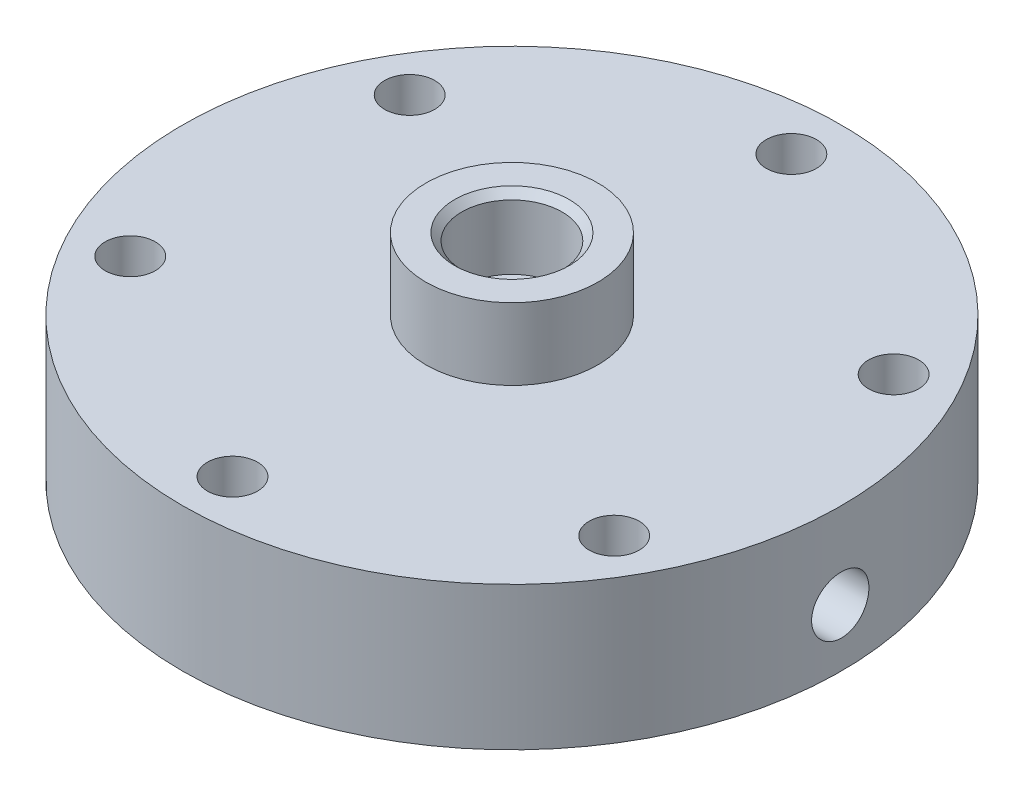
from build123d import *

# Parameters (mm, degrees)
SKETCH1_R           = 46
SKETCH1_R_2         = 3.5
BOSS_EXTRUDE1_DEPTH = 20
SKETCH2_R           = 12
BOSS_EXTRUDE2_DEPTH = 10
SKETCH3_R           = 33
CUT_EXTRUDE1_DEPTH  = 14
SKETCH4_R           = 2.5
CUT_EXTRUDE2_DEPTH  = 6
SKETCH5_R           = 7
CUT_EXTRUDE3_DEPTH  = 10
CHAMFER2_SIZE       = 1
SKETCH6_R           = 4
CUT_EXTRUDE4_DEPTH  = 72.637978754


with BuildPart() as part:
    # Sketch1 → Boss-Extrude1 (new body)
    with BuildSketch(Plane(origin=(0, 0, 0), x_dir=(1, 0, 0), z_dir=(0, 1, 0))):
        with Locations(Location((0, 0, 0), (0, 0, 270))):
            Circle(SKETCH1_R)
        with Locations(Location((0, 39, 0), (0, 0, 270))):
            Circle(SKETCH1_R_2, mode=Mode.SUBTRACT)
        with Locations(Location((33.774990748, 19.5, 0), (0, 0, 270))):
            Circle(SKETCH1_R_2, mode=Mode.SUBTRACT)
        with Locations(Location((33.774990748, -19.5, 0), (0, 0, 270))):
            Circle(SKETCH1_R_2, mode=Mode.SUBTRACT)
        with Locations(Location((0, -39, 0), (0, 0, 270))):
            Circle(SKETCH1_R_2, mode=Mode.SUBTRACT)
        with Locations(Location((-33.774990748, -19.5, 0), (0, 0, 270))):
            Circle(SKETCH1_R_2, mode=Mode.SUBTRACT)
        with Locations(Location((-33.774990748, 19.5, 0), (0, 0, 270))):
            Circle(SKETCH1_R_2, mode=Mode.SUBTRACT)
    extrude(amount=BOSS_EXTRUDE1_DEPTH)

    # Sketch2 → Boss-Extrude2 (add)
    with BuildSketch(Plane(origin=(0, 20, 0), x_dir=(1, 0, 0), z_dir=(0, 1, 0))):
        with Locations(Location((0, 0, 0), (0, 0, 270))):
            Circle(SKETCH2_R)
    extrude(amount=BOSS_EXTRUDE2_DEPTH)

    # Sketch3 → Cut-Extrude1 (cut)
    with BuildSketch(Plane.XZ):
        with Locations(Location((0, 0, 0), (0, 0, 270))):
            Circle(SKETCH3_R)
    extrude(amount=-CUT_EXTRUDE1_DEPTH, mode=Mode.SUBTRACT)

    # Sketch4 → Cut-Extrude2 (cut)
    with BuildSketch(Plane.XZ.offset(-14)):
        with Locations(Location((0, 0, 0), (0, 0, 270))):
            Circle(SKETCH4_R)
    extrude(amount=-CUT_EXTRUDE2_DEPTH, mode=Mode.SUBTRACT)

    # Sketch5 → Cut-Extrude3 (cut)
    with BuildSketch(Plane(origin=(0, 30, 0), x_dir=(1, 0, 0), z_dir=(0, 1, 0))):
        with Locations(Location((0, 0, 0), (0, 0, 270))):
            Circle(SKETCH5_R)
    extrude(amount=-CUT_EXTRUDE3_DEPTH, mode=Mode.SUBTRACT)

    # Chamfer2
    chamfer2_edges = [part.edges().sort_by_distance(p)[0] for p in [
        (0, 30, -7),
    ]]
    chamfer(chamfer2_edges, length=CHAMFER2_SIZE)

    # Sketch6 → Cut-Extrude4 (cut, through all)
    with BuildSketch(Plane(origin=(0, 0, 0), x_dir=(0, 0, -1), z_dir=(1, 0, 0))):
        with Locations(Location((0, 8, 0), (0, 0, 180))):
            Circle(SKETCH6_R)
    extrude(amount=CUT_EXTRUDE4_DEPTH, mode=Mode.SUBTRACT)


solid = part.part
